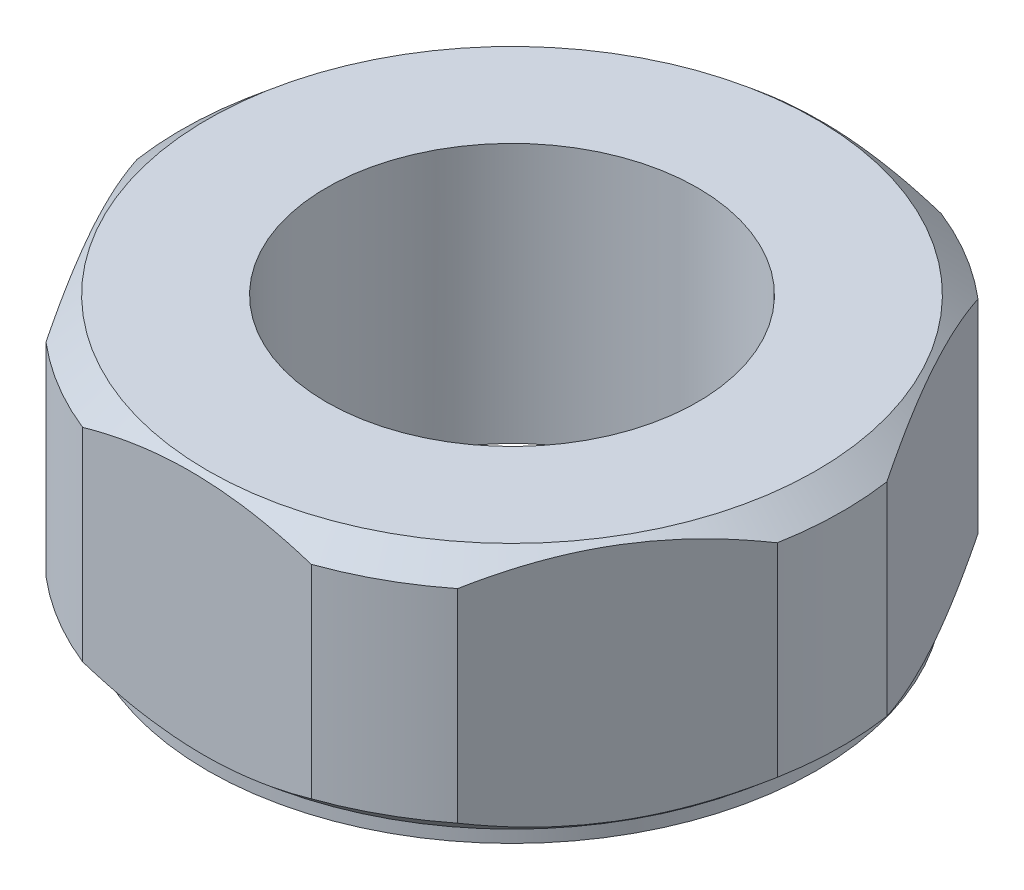
from build123d import *

# Parameters (mm, degrees)
BOSS_EXTRUDE1_DEPTH = 2
SKETCH2_R           = 1.5
CUT_EXTRUDE1_DEPTH  = 2.2
BOSS_EXTRUDE2_START = 0.1
SKETCH4_R           = 2.459458956
SKETCH4_R_2         = 1.5
BOSS_EXTRUDE2_DEPTH = 0.1


with BuildPart() as part:
    # Sketch1 → Boss-Extrude1 (new body)
    with BuildSketch(Plane(origin=(0, 0, 0), x_dir=(1, 0, 0), z_dir=(0, 1, 0))):
        Polygon((-1.396774529, 2.526332173), (-2.886255105, 0.053523861), (-1.489480575, -2.472808312), (1.396774529, -2.526332173), (2.886255105, -0.053523861), (1.489480575, 2.472808312), align=None)
    extrude(amount=BOSS_EXTRUDE1_DEPTH)

    # Sketch2 → Cut-Extrude1 (cut)
    with BuildSketch(Plane.XZ):
        with Locations(Location((0, 0, 0), (0, 0, 270))):
            Circle(SKETCH2_R)
    extrude(amount=-CUT_EXTRUDE1_DEPTH, mode=Mode.SUBTRACT)

    # Sketch3 → Cut-Revolve1 (revolve, cut)
    with BuildSketch(Plane(origin=(0, 0, 0), x_dir=(0, 0, -1), z_dir=(1, 0, 0)), mode=Mode.PRIVATE) as cut_revolve1_sk:
        Polygon((2.317459596, 2.120153304), (2.671353793, 1.820704368), (2.671353793, 0.179295632), (2.317459596, -0.120153304), (3.58564164, -0.304151817), (3.641464091, 2.445397761), align=None)
    revolve(cut_revolve1_sk.sketch.rotate(Axis((0, 0, 0), (0, 1, 0)), 19.570878152), axis=Axis((0, 0, 0), (0, 1, 0)), mode=Mode.SUBTRACT)

    # Sketch4 → Boss-Extrude2 (add)
    with BuildSketch(Plane.XZ.offset(BOSS_EXTRUDE2_START)):
        with Locations(Location((0, 0, 0), (0, 0, 90))):
            Circle(SKETCH4_R)
        with Locations(Location((0, 0, 0), (0, 0, 270))):
            Circle(SKETCH4_R_2, mode=Mode.SUBTRACT)
    extrude(amount=-BOSS_EXTRUDE2_DEPTH)


solid = part.part
